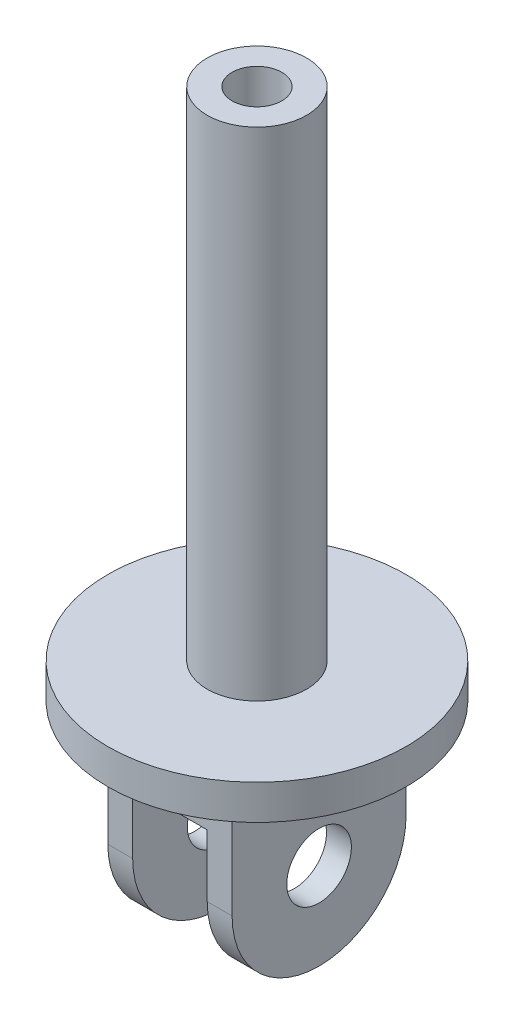
from build123d import *

# Parameters (mm, degrees)
SKETCH1_W           = 25
SKETCH1_H           = 35
BOSS_EXTRUDE1_DEPTH = 40
FILLET1_RADIUS      = 17.5
FILLET1_LENGTH      = 25
SKETCH2_W           = 15
SKETCH2_H           = 35
CUT_EXTRUDE1_DEPTH  = 30
SKETCH3_R           = 6.5
CUT_EXTRUDE2_DEPTH  = 30
SKETCH5_R           = 30
BOSS_EXTRUDE2_DEPTH = 7
SKETCH6_R           = 10
SKETCH6_R_2         = 5
BOSS_EXTRUDE3_DEPTH = 100


with BuildPart() as part:
    # Sketch1 → Boss-Extrude1 (new body)
    with BuildSketch(Plane(origin=(0, 0, 0), x_dir=(1, 0, 0), z_dir=(0, 1, 0))):
        Rectangle(SKETCH1_W, SKETCH1_H)
    extrude(amount=BOSS_EXTRUDE1_DEPTH)

    # Fillet1: full round fillet: the end face becomes a half cylinder, R = half its width
    fillet1_face = Plane((0, 0, 0), x_dir=(-1, 0, 0), z_dir=(0, -1, 0))  # on the end face: x along it, z out of the body
    fillet1_slab = fillet1_face.offset(-FILLET1_RADIUS / 2) * Box(FILLET1_LENGTH, 2 * FILLET1_RADIUS, FILLET1_RADIUS, mode=Mode.PRIVATE)  # the body's end, R deep
    fillet1_round = Plane((0, 17.5, 0), x_dir=(0, -1, 0), z_dir=(-1, 0, 0)) * Cylinder(FILLET1_RADIUS, FILLET1_LENGTH, mode=Mode.PRIVATE)  # its axis R under the face
    add(fillet1_slab - fillet1_round, mode=Mode.SUBTRACT)

    # Sketch2 → Cut-Extrude1 (cut)
    with BuildSketch(Plane(origin=(0, 0, 0), x_dir=(1, 0, 0), z_dir=(0, 1, 0))):
        Rectangle(SKETCH2_W, SKETCH2_H)
    extrude(amount=CUT_EXTRUDE1_DEPTH, mode=Mode.SUBTRACT)

    # Sketch3 → Cut-Extrude2 (cut)
    with BuildSketch(Plane.ZY.offset(12.5)):
        with Locations((0, 17.5)):
            Circle(SKETCH3_R)
    extrude(amount=-CUT_EXTRUDE2_DEPTH, mode=Mode.SUBTRACT)

    # Sketch5 → Boss-Extrude2 (add)
    with BuildSketch(Plane(origin=(0, 40, 0), x_dir=(1, 0, 0), z_dir=(0, 1, 0))):
        with Locations(Location((0, 0, 0), (0, 0, 270))):
            Circle(SKETCH5_R)
    extrude(amount=BOSS_EXTRUDE2_DEPTH)

    # Sketch6 → Boss-Extrude3 (add)
    with BuildSketch(Plane(origin=(0, 47, 0), x_dir=(1, 0, 0), z_dir=(0, 1, 0))):
        with Locations(Location((0, 0, 0), (0, 0, 270))):
            Circle(SKETCH6_R)
        with Locations(Location((0, 0, 0), (0, 0, 270))):
            Circle(SKETCH6_R_2, mode=Mode.SUBTRACT)
    extrude(amount=BOSS_EXTRUDE3_DEPTH)


solid = part.part
